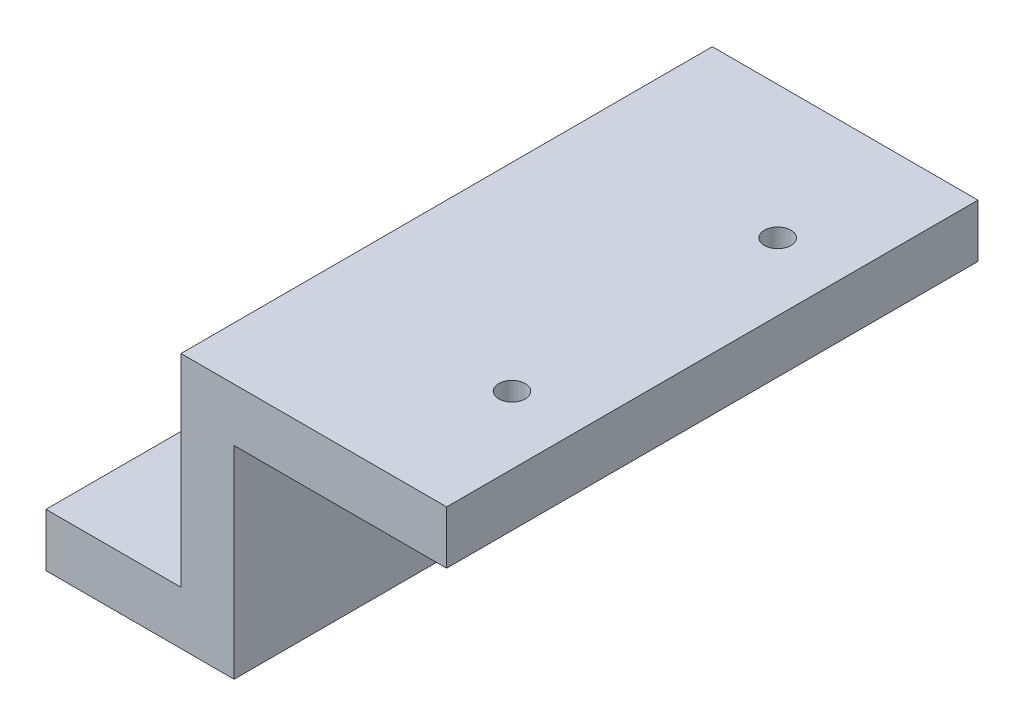
from build123d import *

# Parameters (mm, degrees)
SKETCH1_W             = 50
SKETCH1_H             = 10
BOSS_EXTRUDE1_DEPTH   = 100
SKETCH2_W             = 10
SKETCH2_H             = 100
BOSS_EXTRUDE2_DEPTH   = 38.1
SKETCH3_W             = 100
SKETCH3_H             = 10
BOSS_EXTRUDE3_DEPTH   = 25.4
M5X0_8_TAPPED_HOLE1_D = 5
M5X0_8_TAPPED_HOLE2_D = 5


with BuildPart() as part:
    # Sketch1 → Boss-Extrude1 (new body)
    with BuildSketch(Plane.XY):
        Rectangle(SKETCH1_W, SKETCH1_H)
    extrude(amount=BOSS_EXTRUDE1_DEPTH)

    # Sketch2 → Boss-Extrude2 (add)
    with BuildSketch(Plane.XZ.offset(5)):
        with Locations((-20, 50)):
            Rectangle(SKETCH2_W, SKETCH2_H)
    extrude(amount=BOSS_EXTRUDE2_DEPTH)

    # Sketch3 → Boss-Extrude3 (add)
    with BuildSketch(Plane.ZY.offset(25)):
        with Locations((50, -38.1)):
            Rectangle(SKETCH3_W, SKETCH3_H)
    extrude(amount=BOSS_EXTRUDE3_DEPTH)

    # M5x0.8 Tapped Hole1 (through all)
    with Locations(Plane(origin=(0, 5, 0), x_dir=(1, 0, 0), z_dir=(0, 1, 0))):
        with Locations((12.3, -75), (12.3, -25)):
            Hole(M5X0_8_TAPPED_HOLE1_D / 2)

    # M5x0.8 Tapped Hole2 (through all)
    with Locations(Plane(origin=(-15, 0, 0), x_dir=(0, 0, -1), z_dir=(1, 0, 0))):
        with Locations((-27, -8.1), (-73, -26.1), (-27, -26.1), (-73, -8.1)):
            Hole(M5X0_8_TAPPED_HOLE2_D / 2)


solid = part.part
